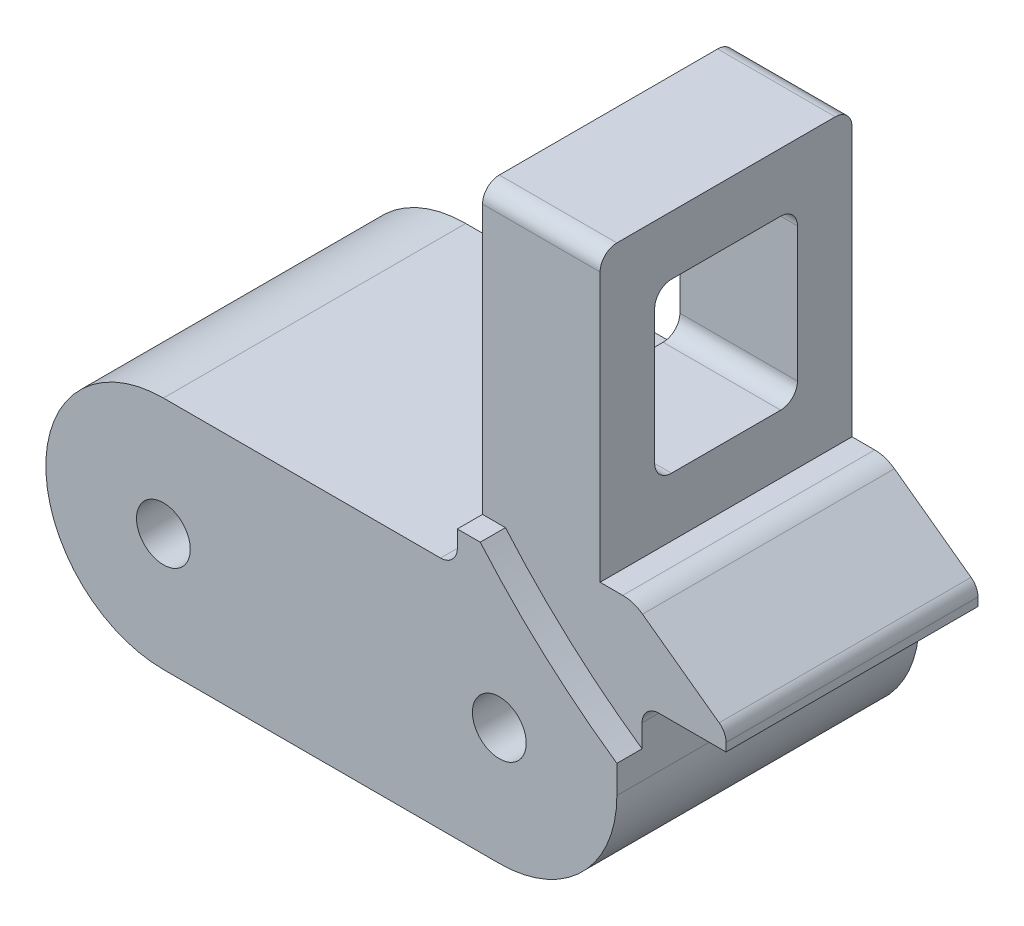
from build123d import *
from build123d.topology import SkipClean

# Parameters (mm, degrees)
SKETCH_1_R          = 7
SKETCH_1_R_2        = 1.6
EXTRUDE_1_DEPTH     = 14
FILLET_2_R          = 1
FILLET_4_R          = 2
FILLET_5_R          = 1
CUT_EXTRUDE_1_DEPTH = 10
SKETCH_4_R          = 43
SKETCH_4_W          = 56
SKETCH_4_H          = 56
CUT_EXTRUDE_2_DEPTH = 2
SKETCH_5_R          = 1.6
EXTRUDE_3_DEPTH     = 2
EXTRUDE_START       = 2
SKETCH_6_R          = 1.6
EXTRUDE_4_DEPTH     = 2
EXTRUDE_START_2     = 2.5
EXTRUDE_6_DEPTH     = 2.5
EXTRUDE_7_DEPTH     = 2.5
CUT_EXTRUDE_3_DEPTH = 43.558782877
SKETCH_15_W         = 6
SKETCH_15_H         = 15
EXTRUDE_10_DEPTH    = 1
EXTRUDE_START_3     = 1
SKETCH_14_W         = 15
SKETCH_14_H         = 17
EXTRUDE_9_DEPTH     = 1
FILLET_6_R          = 1


with BuildPart() as part:
    # 草图1 → 凸台-拉伸1 (new body)
    # profile 1 of 3: a face of its own
    with BuildSketch(Plane.XY):
        with BuildLine():
            Line((-2.5, 7), (-20, 7))
            ThreePointArc((-20, 7), (-15.050252532, 4.949747468), (-13, 0))
            ThreePointArc((-13, 0), (-15.050252532, -4.949747468), (-20, -7))
            Line((-20, -7), (0, -7))
            ThreePointArc((0, -7), (-4.949747468, 4.949747468), (7, 0))
            Line((7, 0), (7, 4))
            Line((7, 4), (12, 4))
            Line((12, 4), (12, 5))
            Line((12, 5), (6.5, 9))
            Line((6.5, 9), (3.5, 9))
            Line((3.5, 9), (3.5, 26))
            Line((3.5, 26), (-2.5, 26))
            Line((-2.5, 26), (-2.5, 7))
        make_face()
    # profile 2 of 3: a face of its own
    with BuildSketch(Plane.XY):
        Circle(SKETCH_1_R)
        Circle(SKETCH_1_R_2, mode=Mode.SUBTRACT)
    # profile 3 of 3: a face of its own
    with BuildSketch(Plane.XY):
        with Locations((-20, 0)):
            Circle(SKETCH_1_R)
        with Locations((-20, 0)):
            Circle(SKETCH_1_R_2, mode=Mode.SUBTRACT)
    extrude(amount=EXTRUDE_1_DEPTH)

    # 圆角2
    fillet_2_edges = [part.edges().sort_by_distance(p)[0] for p in [
        (-2.5, 7, 7),
        (7, 4, 7),
    ]]
    fillet(fillet_2_edges, radius=FILLET_2_R)

    # 圆角4
    fillet_4_edges = [part.edges().sort_by_distance(p)[0] for p in [
        (6.5, 9, 7),
    ]]
    fillet(fillet_4_edges, radius=FILLET_4_R)

    # 圆角5
    fillet_5_edges = [part.edges().sort_by_distance(p)[0] for p in [
        (12, 5, 7),
    ]]
    fillet(fillet_5_edges, radius=FILLET_5_R)

    # 草图2 → 切除-拉伸1 (cut)
    with BuildSketch(Plane(origin=(3.5, 0, 0), x_dir=(0, 0, -1), z_dir=(1, 0, 0))):
        Polygon((-12, 9), (-14, 9), (-14, 26), (0, 26), (0, 9), (-2, 9), (-2, 25), (-12, 25), align=None)
    extrude(amount=-CUT_EXTRUDE_1_DEPTH, mode=Mode.SUBTRACT)

    # 草图4 → 切除-拉伸2 (cut)
    with BuildSketch(Plane.XY.offset(14)):
        with Locations((31.5, 37)):
            Circle(SKETCH_4_R)
        with Locations((31.5, 37)):
            Rectangle(SKETCH_4_W, SKETCH_4_H, mode=Mode.SUBTRACT)
    cut_extrude_2 = extrude(amount=-CUT_EXTRUDE_2_DEPTH, mode=Mode.SUBTRACT)

    # 镜向1: 切除-拉伸2 across plane
    add(cut_extrude_2.mirror(Plane.XY.offset(7)), mode=Mode.SUBTRACT)

    # 草图5 → 凸台-拉伸3 (add)
    with SkipClean():  # the faces are left unmerged after this step: merging them gives an invalid solid
        with BuildSketch(Plane.XY.offset(14)):
            with BuildLine():
                Line((-1.134337744, 9), (-2.5, 9))
                Line((-2.5, 9), (-2.5, 8))
                ThreePointArc((-2.5, 8), (-2.792893219, 7.292893219), (-3.5, 7))
                Line((-3.5, 7), (-20, 7))
                ThreePointArc((-20, 7), (-27, 0), (-20, -7))
                Line((-20, -7), (0, -7))
                ThreePointArc((0, -7), (4.949747468, -4.949747468), (7, 0))
                Line((7, 0), (7, 1.662343032))
                ThreePointArc((7, 1.662343032), (2.698204226, 5.071070168), (-1.134337744, 9))
            make_face()
            Circle(SKETCH_5_R, mode=Mode.SUBTRACT)
            with Locations((-20, 0)):
                Circle(SKETCH_5_R, mode=Mode.SUBTRACT)
        extrude(amount=EXTRUDE_3_DEPTH)

    # 草图6 → 凸台-拉伸4 (add)
    with SkipClean():  # the faces are left unmerged after this step: merging them gives an invalid solid
        with BuildSketch(Plane(origin=(0, 0, 0), x_dir=(-1, 0, 0), z_dir=(0, 0, -1)).offset(EXTRUDE_START)):
            with BuildLine():
                Line((-7, 1.662343032), (-7, 0))
                ThreePointArc((-7, 0), (-4.949747468, -4.949747468), (0, -7))
                Line((0, -7), (20, -7))
                ThreePointArc((20, -7), (27, 0), (20, 7))
                Line((20, 7), (3.5, 7))
                ThreePointArc((3.5, 7), (2.792893219, 7.292893219), (2.5, 8))
                Line((2.5, 8), (2.5, 9))
                Line((2.5, 9), (1.134337744, 9))
                ThreePointArc((1.134337744, 9), (-2.698204226, 5.071070168), (-7, 1.662343032))
            make_face()
            with Locations((20, 0)):
                Circle(SKETCH_6_R, mode=Mode.SUBTRACT)
            Circle(SKETCH_6_R, mode=Mode.SUBTRACT)
        extrude(amount=-EXTRUDE_4_DEPTH)

    # 草图8 → 凸台-拉伸6 (add)
    with BuildSketch(Plane.XY.offset(12).offset(EXTRUDE_START_2)):
        with BuildLine():
            Line((-2.5, 9), (-1.134337744, 9))
            ThreePointArc((-1.134337744, 9), (2.698204226, 5.071070168), (7, 1.662343032))
            Line((7, 1.662343032), (7, 3))
            ThreePointArc((7, 3), (7.292893219, 3.707106781), (8, 4))
            Line((8, 4), (12, 4))
            Line((12, 4), (12, 4.490775408))
            ThreePointArc((12, 4.490775408), (11.891114947, 4.944553053), (11.588171698, 5.299511493))
            Line((11.588171698, 5.299511493), (7.025975768, 8.617472169))
            ThreePointArc((7.025975768, 8.617472169), (6.468120717, 8.901965344), (5.849632373, 9))
            Line((5.849632373, 9), (3.5, 9))
            Line((3.5, 9), (3.5, 25))
            Line((3.5, 25), (-2.5, 25))
            Line((-2.5, 25), (-2.5, 9))
        make_face()
    extrude(amount=-EXTRUDE_6_DEPTH)

    # 草图9 → 凸台-拉伸7 (add)
    with BuildSketch(Plane(origin=(0, 0, 2), x_dir=(-1, 0, 0), z_dir=(0, 0, -1))):
        with BuildLine():
            Line((-3.5, 25), (-3.5, 9))
            Line((-3.5, 9), (-5.849632373, 9))
            ThreePointArc((-5.849632373, 9), (-6.468120717, 8.901965344), (-7.025975768, 8.617472169))
            Line((-7.025975768, 8.617472169), (-11.588171698, 5.299511493))
            ThreePointArc((-11.588171698, 5.299511493), (-11.891114947, 4.944553053), (-12, 4.490775408))
            Line((-12, 4.490775408), (-12, 4))
            Line((-12, 4), (-8, 4))
            ThreePointArc((-8, 4), (-7.292893219, 3.707106781), (-7, 3))
            Line((-7, 3), (-7, 1.662343032))
            ThreePointArc((-7, 1.662343032), (-2.698204226, 5.071070168), (1.134337744, 9))
            Line((1.134337744, 9), (2.5, 9))
            Line((2.5, 9), (2.5, 25))
            Line((2.5, 25), (-3.5, 25))
        make_face()
    extrude(amount=EXTRUDE_7_DEPTH)

    # 草图13 → 切除-拉伸3 (cut, through all)
    with BuildSketch(Plane(origin=(3.5, 0, 0), x_dir=(0, 0, -1), z_dir=(1, 0, 0))):
        with BuildLine():
            Line((-10.25, 22.5), (-3.75, 22.5))
            ThreePointArc((-3.75, 22.5), (-3.042893219, 22.207106781), (-2.75, 21.5))
            Line((-2.75, 21.5), (-2.75, 13.5))
            ThreePointArc((-2.75, 13.5), (-3.042893219, 12.792893219), (-3.75, 12.5))
            Line((-3.75, 12.5), (-10.25, 12.5))
            ThreePointArc((-10.25, 12.5), (-10.957106781, 12.792893219), (-11.25, 13.5))
            Line((-11.25, 13.5), (-11.25, 21.5))
            ThreePointArc((-11.25, 21.5), (-10.957106781, 22.207106781), (-10.25, 22.5))
        make_face()
    extrude(amount=-CUT_EXTRUDE_3_DEPTH, mode=Mode.SUBTRACT)

    # 草图15 → 凸台-拉伸10 (add)
    with BuildSketch(Plane(origin=(0, 25, 0), x_dir=(1, 0, 0), z_dir=(0, 1, 0))):
        with Locations((0.5, -7)):
            Rectangle(SKETCH_15_W, SKETCH_15_H)
    extrude(amount=EXTRUDE_10_DEPTH)

    # 草图14 → 凸台-拉伸9 (add)
    with BuildSketch(Plane(origin=(3.5, 0, 0), x_dir=(0, 0, -1), z_dir=(1, 0, 0)).offset(EXTRUDE_START_3)):
        with Locations((-7, 17.5)):
            Rectangle(SKETCH_14_W, SKETCH_14_H)
        with BuildLine():
            Line((-2.75, 13.5), (-2.75, 21.5))
            ThreePointArc((-2.75, 21.5), (-3.042893219, 22.207106781), (-3.75, 22.5))
            Line((-3.75, 22.5), (-10.25, 22.5))
            ThreePointArc((-10.25, 22.5), (-10.957106781, 22.207106781), (-11.25, 21.5))
            Line((-11.25, 21.5), (-11.25, 13.5))
            ThreePointArc((-11.25, 13.5), (-10.957106781, 12.792893219), (-10.25, 12.5))
            Line((-10.25, 12.5), (-3.75, 12.5))
            ThreePointArc((-3.75, 12.5), (-3.042893219, 12.792893219), (-2.75, 13.5))
        make_face(mode=Mode.SUBTRACT)
    extrude(amount=-EXTRUDE_9_DEPTH)

    # 圆角6
    fillet_6_edges = [part.edges().sort_by_distance(p)[0] for p in [
        (1, 26, -0.5),
        (1, 26, 14.5),
    ]]
    fillet(fillet_6_edges, radius=FILLET_6_R)


solid = part.part
